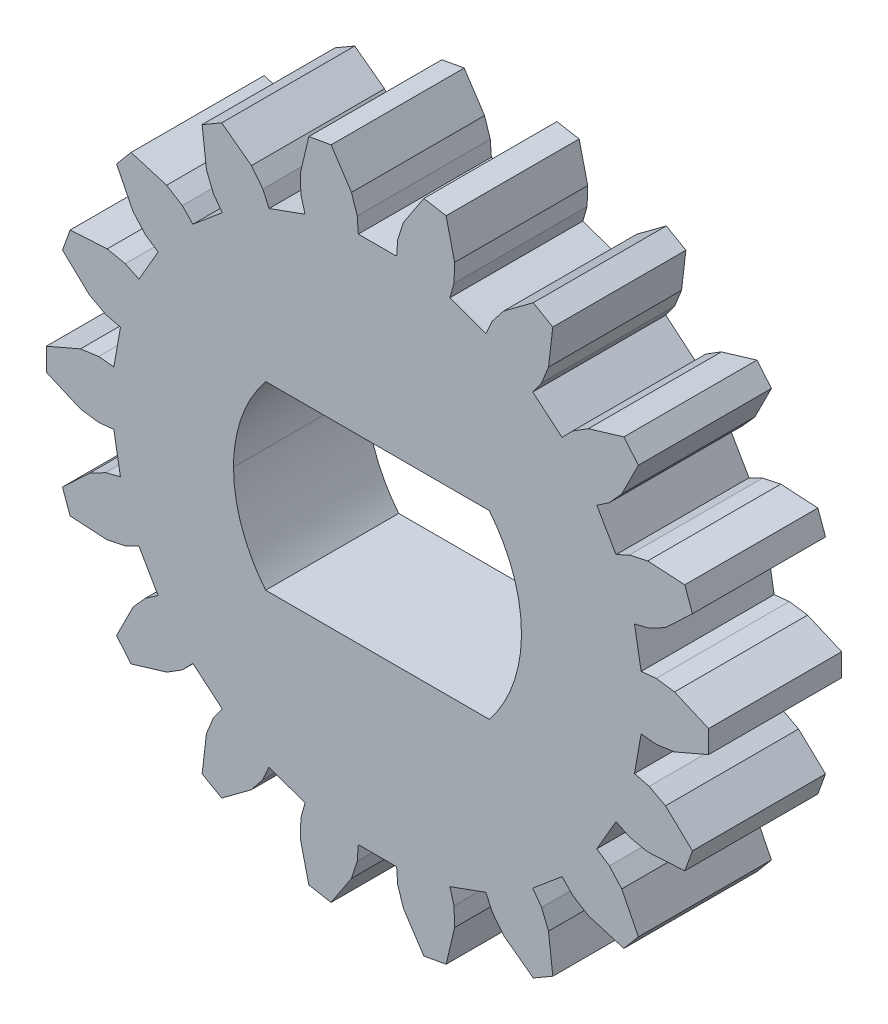
from build123d import *

# Parameters (mm, degrees)
BOSS_EXTRUDE2_DEPTH = 3.175


with BuildPart() as part:
    # sun → Boss-Extrude2 (new body)
    with BuildSketch(Plane(origin=(6.251367358, 48.255911881, 0), x_dir=(1, 0, 0), z_dir=(0, 0, 1))):
        Polygon((44.40620191, 170.247646781), (44.76575291, 170.284335781), (45.20263291, 170.222528781), (46.01571591, 169.872008781), (46.01571591, 169.332963781), (45.20263291, 168.982443781), (44.76575291, 168.920637781), (44.40620191, 168.957326781), (44.24731091, 168.056755781), (44.59783091, 167.968419781), (44.98729791, 167.760986781), (45.63132891, 167.153361781), (45.44703791, 166.647055781), (44.56311791, 166.595690781), (44.13159991, 166.686848781), (43.80619791, 166.844610781), (43.34899791, 166.052695781), (43.64815291, 165.849777781), (43.94307591, 165.521552781), (44.34044391, 164.730201781), (43.99415791, 164.317592781), (43.14579791, 164.571592781), (42.77157091, 164.804990781), (42.51982891, 165.064352781), (41.81907091, 164.476483781), (42.03101991, 164.183537781), (42.19583791, 163.774315781), (42.29856691, 162.894910781), (41.83205291, 162.625388781), (41.12169991, 163.154272781), (40.84991991, 163.501688781), (40.70203591, 163.831606781), (39.84266891, 163.518621781), (39.94144691, 163.170923781), (39.95640391, 162.730092781), (39.75207591, 161.868468781), (39.22149791, 161.775052781), (38.73494691, 162.514757781), (38.59835091, 162.934139781), (38.57210391, 163.294819781), (37.65770391, 163.294819781), (37.63145791, 162.934139781), (37.49486191, 162.514757781), (37.00831091, 161.775052781), (36.47773291, 161.868468781), (36.27340391, 162.730092781), (36.28836191, 163.170923781), (36.38713991, 163.518621781), (35.52777291, 163.831606781), (35.37988891, 163.501688781), (35.10810891, 163.154272781), (34.39775591, 162.625388781), (33.93124191, 162.894910781), (34.03397091, 163.774315781), (34.19878891, 164.183537781), (34.41073791, 164.476483781), (33.70997991, 165.064352781), (33.45823791, 164.804990781), (33.08401091, 164.571592781), (32.23565091, 164.317592781), (31.88936391, 164.730201781), (32.28673291, 165.521552781), (32.58165591, 165.849777781), (32.88081091, 166.052695781), (32.42361091, 166.844610781), (32.09820891, 166.686848781), (31.66669091, 166.595690781), (30.78277091, 166.647055781), (30.59847991, 167.153361781), (31.24251091, 167.760986781), (31.63197791, 167.968419781), (31.98249791, 168.056755781), (31.82360691, 168.957326781), (31.46405591, 168.920637781), (31.02717591, 168.982443781), (30.21409291, 169.332963781), (30.21409291, 169.872008781), (31.02717591, 170.222528781), (31.46405591, 170.284335781), (31.82360691, 170.247646781), (31.98249791, 171.148217781), (31.63197791, 171.236552781), (31.24251091, 171.443986781), (30.59847991, 172.051610781), (30.78277091, 172.557917781), (31.66669091, 172.609281781), (32.09820891, 172.518123781), (32.42361091, 172.360361781), (32.88081091, 173.152277781), (32.58165591, 173.355195781), (32.28673291, 173.683419781), (31.88936391, 174.474770781), (32.23565091, 174.887379781), (33.08401091, 174.633379781), (33.45823791, 174.399981781), (33.70997991, 174.140619781), (34.41073791, 174.728488781), (34.19878891, 175.021435781), (34.03397091, 175.430657781), (33.93124191, 176.310061781), (34.39775591, 176.579583781), (35.10810891, 176.050699781), (35.37988891, 175.703283781), (35.52777291, 175.373366781), (36.38713991, 175.686350781), (36.28836191, 176.034048781), (36.27340391, 176.474879781), (36.47773291, 177.336503781), (37.00831091, 177.429919781), (37.49486191, 176.690215781), (37.63145791, 176.270832781), (37.65770391, 175.910152781), (38.57210391, 175.910152781), (38.59835091, 176.270832781), (38.73494691, 176.690215781), (39.22149791, 177.429919781), (39.75207591, 177.336503781), (39.95640391, 176.474879781), (39.94144691, 176.034048781), (39.84266891, 175.686350781), (40.70203591, 175.373366781), (40.84991991, 175.703283781), (41.12169991, 176.050699781), (41.83205291, 176.579583781), (42.29856691, 176.310061781), (42.19583791, 175.430657781), (42.03101991, 175.021435781), (41.81907091, 174.728488781), (42.51982891, 174.140619781), (42.77157091, 174.399981781), (43.14579791, 174.633379781), (43.99415791, 174.887379781), (44.34044391, 174.474770781), (43.94307591, 173.683419781), (43.64815291, 173.355195781), (43.34899791, 173.152277781), (43.80619791, 172.360361781), (44.13159991, 172.518123781), (44.56311791, 172.609281781), (45.44703791, 172.557917781), (45.63132891, 172.051610781), (44.98729791, 171.443986781), (44.59783091, 171.236552781), (44.24731091, 171.148217781), align=None)
        with BuildLine():
            Line((35.44702391, 167.446136781), (40.78278491, 167.446136781))
            add(Edge.make_bspline(
                [(40.78278491, 167.446136781), (41.26046891, 168.035989781), (41.55007691, 168.788751781), (41.55007691, 169.606900781)],
                knots=[0, 0, 0, 0, 1, 1, 1, 1], degree=3))
            add(Edge.make_bspline(
                [(41.55007691, 169.606900781), (41.55007691, 170.425048781), (41.26046891, 171.168991781), (40.78278491, 171.758844781)],
                knots=[0, 0, 0, 0, 1, 1, 1, 1], degree=3))
            Line((40.78278491, 171.758844781), (35.44702391, 171.758844781))
            add(Edge.make_bspline(
                [(35.44702391, 171.758844781), (34.96933991, 171.168991781), (34.67973191, 170.425048781), (34.67973191, 169.606900781)],
                knots=[0, 0, 0, 0, 1, 1, 1, 1], degree=3))
            add(Edge.make_bspline(
                [(34.67973191, 169.606900781), (34.67973191, 168.788751781), (34.96933991, 168.035989781), (35.44702391, 167.446136781)],
                knots=[0, 0, 0, 0, 1, 1, 1, 1], degree=3))
        make_face(mode=Mode.SUBTRACT)
    extrude(amount=BOSS_EXTRUDE2_DEPTH)


solid = part.part
